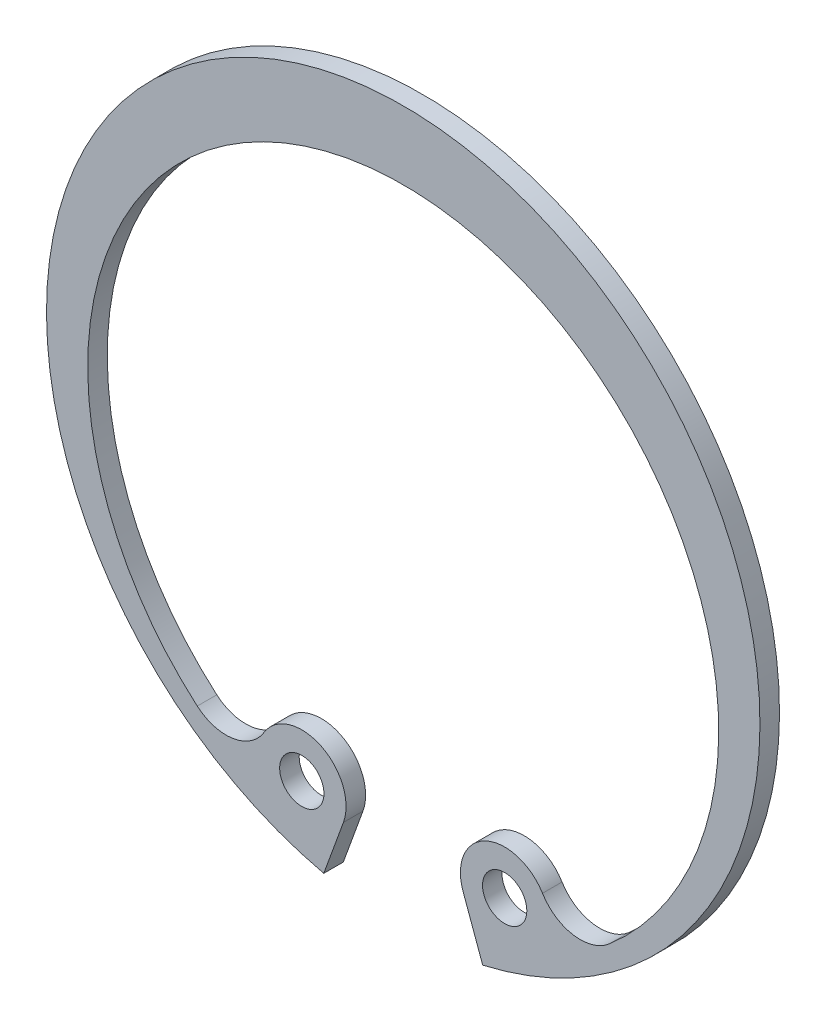
from build123d import *
from build123d.topology import SkipClean

# Parameters (mm, degrees)
SKETCH1_R                 = 21
EXTRUDE1_DEPTH            = 1.15
SKETCH34_R                = 1.303333333
F_056_250_SNAP_RING_DEPTH = 1.15
SKETCH35_R                = 21
CUT_EXTRUDE1_DEPTH        = 1.15


with BuildPart() as part:
    # Sketch1 → Extrude1 (new body)
    with BuildSketch(Plane.XY):
        Circle(SKETCH1_R)
    extrude(amount=EXTRUDE1_DEPTH)

    # Sketch34 → 056-250 Snap Ring (add)
    with SkipClean():  # the faces are left unmerged after this step: merging them gives an invalid solid
        with BuildSketch(Plane.XY.offset(1.15)):
            with BuildLine():
                Line((-3.522256245, -17.298702968), (-4.677411169, -20.472465039))
                ThreePointArc((-4.677411169, -20.472465039), (0, 21), (4.677411169, -20.472465039))
                Line((4.677411169, -20.472465039), (3.522256245, -17.298702968))
                ThreePointArc((3.522256245, -17.298702968), (4.842117839, -14.057977774), (8.197569602, -15.050589419))
                ThreePointArc((8.197569602, -15.050589419), (10.018304079, -16.269002398), (12.125199981, -15.668507704))
                ThreePointArc((12.125199981, -15.668507704), (0, 16.9723), (-12.125199981, -15.668507704))
                ThreePointArc((-12.125199981, -15.668507704), (-10.018304079, -16.269002398), (-8.197569602, -15.050589419))
                ThreePointArc((-8.197569602, -15.050589419), (-4.842117839, -14.057977774), (-3.522256245, -17.298702968))
            make_face()
            with Locations((5.971721676, -16.407170461)):
                Circle(SKETCH34_R, mode=Mode.SUBTRACT)
            with Locations((-5.971721676, -16.407170461)):
                Circle(SKETCH34_R, mode=Mode.SUBTRACT)
        extrude(amount=F_056_250_SNAP_RING_DEPTH)

    # Sketch35 → Cut-Extrude1 (cut)
    with BuildSketch(Plane(origin=(0, 0, 0), x_dir=(-1, 0, 0), z_dir=(0, 0, -1))):
        Circle(SKETCH35_R)
    extrude(amount=-CUT_EXTRUDE1_DEPTH, mode=Mode.SUBTRACT)


solid = part.part
